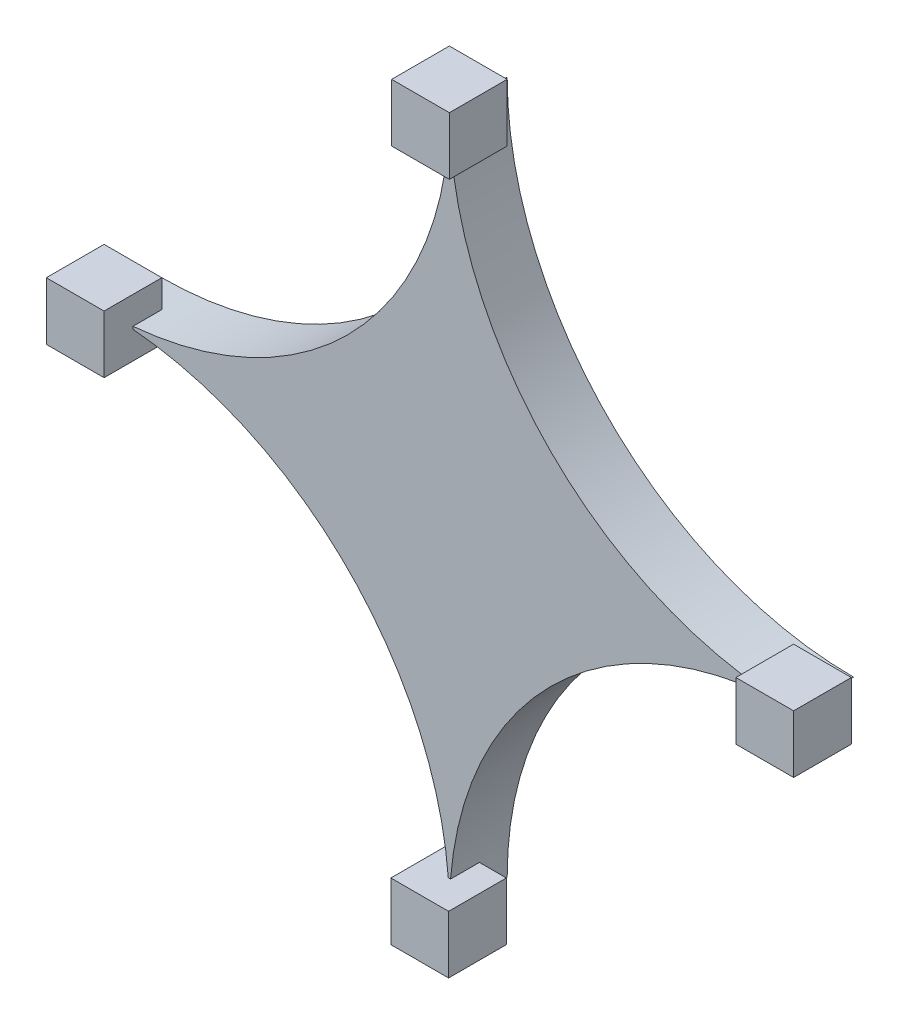
from build123d import *

# Parameters (mm, degrees)
BOSS_EXTRUDE2_DEPTH = 10
SKETCH2_W           = 10
SKETCH2_H           = 10
BOSS_EXTRUDE3_DEPTH = 5


with BuildPart() as part:
    # Sketch1 → Boss-Extrude2 (new body)
    with BuildSketch(Plane.XY):
        with BuildLine():
            ThreePointArc((0, 60), (17.573593129, 17.573593129), (60, 0))
            ThreePointArc((60, 0), (17.573593129, -17.573593129), (0, -60))
            ThreePointArc((0, -60), (-17.573593129, -17.573593129), (-60, 0))
            ThreePointArc((-60, 0), (-17.573593129, 17.573593129), (0, 60))
        make_face()
    extrude(amount=BOSS_EXTRUDE2_DEPTH)

    # Sketch2 → Boss-Extrude3 (add, symmetric)
    with BuildSketch(Plane.XY.offset(10)):
        with Locations((-0.141365773, -60.179831665)):
            Rectangle(SKETCH2_W, SKETCH2_H)
        with Locations((59.60084876, -0.244611601)):
            Rectangle(SKETCH2_W, SKETCH2_H)
        with Locations((-59.798330542, 0.00957883)):
            Rectangle(SKETCH2_W, SKETCH2_H)
        with Locations((-0.007106667, 59.651317451)):
            Rectangle(SKETCH2_W, SKETCH2_H)
    extrude(amount=BOSS_EXTRUDE3_DEPTH, both=True)


solid = part.part
